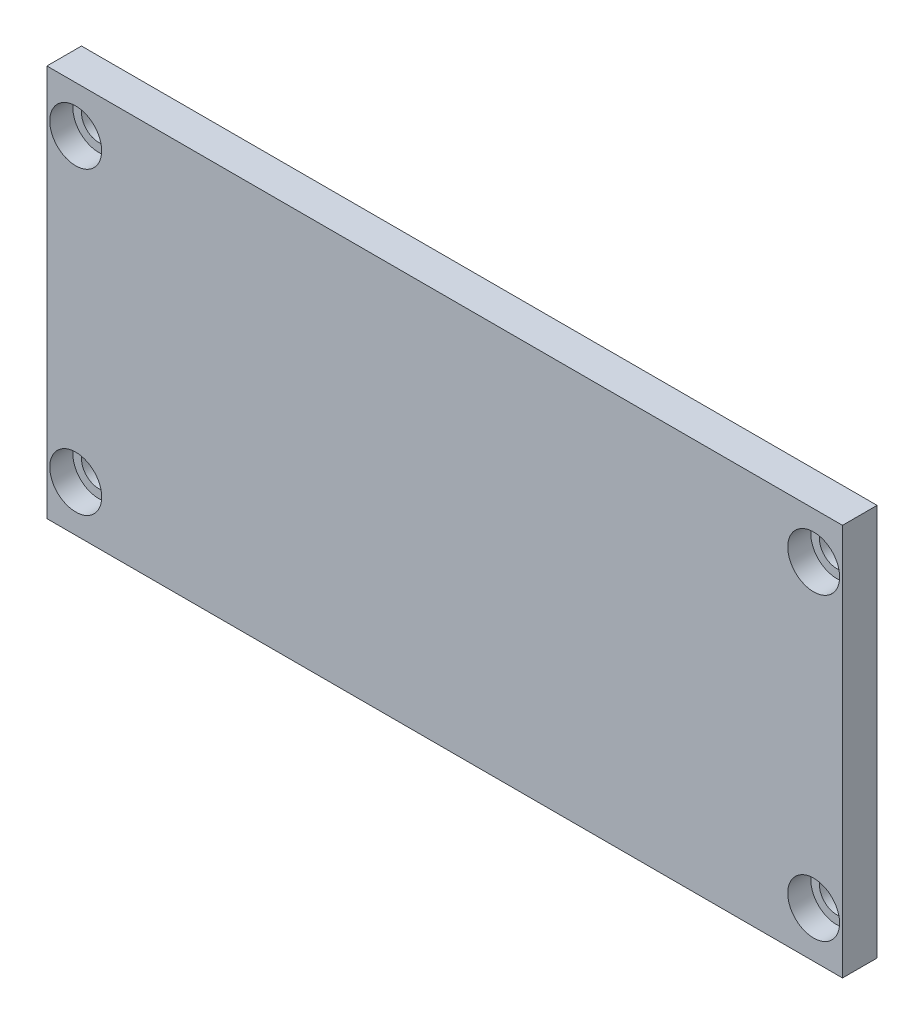
from build123d import *

# Parameters (mm, degrees)
SZKIC1_W                    = 69
SZKIC1_H                    = 34
DODANIE_WYCI_GNI_CIE1_DEPTH = 3
SZKIC2_R                    = 1.5
WYTNIJ_WYCI_GNI_CIE1_DEPTH  = 3
SZKIC3_R                    = 2.25
WYTNIJ_WYCI_GNI_CIE2_DEPTH  = 2


with BuildPart() as part:
    # Szkic1 → Dodanie-wyciągnięcie1 (new body)
    with BuildSketch(Plane.XY):
        with Locations((34.5, 17)):
            Rectangle(SZKIC1_W, SZKIC1_H)
    extrude(amount=DODANIE_WYCI_GNI_CIE1_DEPTH)

    # Szkic2 → Wytnij-wyciągnięcie1 (cut)
    with BuildSketch(Plane.XY.offset(3)):
        with Locations((2.5, 30)):
            Circle(SZKIC2_R)
        with Locations((2.5, 4)):
            Circle(SZKIC2_R)
        with Locations((66.5, 4)):
            Circle(SZKIC2_R)
        with Locations((66.5, 30)):
            Circle(SZKIC2_R)
    extrude(amount=-WYTNIJ_WYCI_GNI_CIE1_DEPTH, mode=Mode.SUBTRACT)

    # Szkic3 → Wytnij-wyciągnięcie2 (cut)
    with BuildSketch(Plane.XY.offset(3)):
        with Locations((2.5, 30)):
            Circle(SZKIC3_R)
        with Locations((66.5, 30)):
            Circle(SZKIC3_R)
        with Locations((2.5, 4)):
            Circle(SZKIC3_R)
        with Locations((66.5, 4)):
            Circle(SZKIC3_R)
    extrude(amount=-WYTNIJ_WYCI_GNI_CIE2_DEPTH, mode=Mode.SUBTRACT)


solid = part.part
